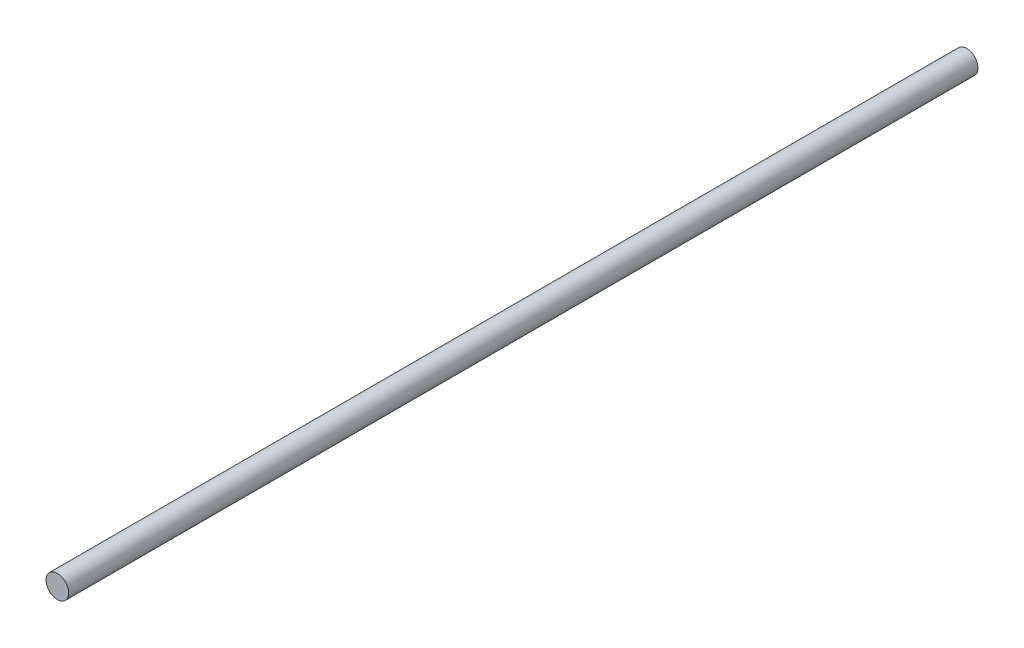
from build123d import *

# Parameters (mm, degrees)
SKETCH2_R           = 1
BOSS_EXTRUDE1_DEPTH = 80


with BuildPart() as part:
    # Sketch2 → Boss-Extrude1 (new body)
    with BuildSketch(Plane.XY):
        Circle(SKETCH2_R)
    extrude(amount=BOSS_EXTRUDE1_DEPTH)


solid = part.part
